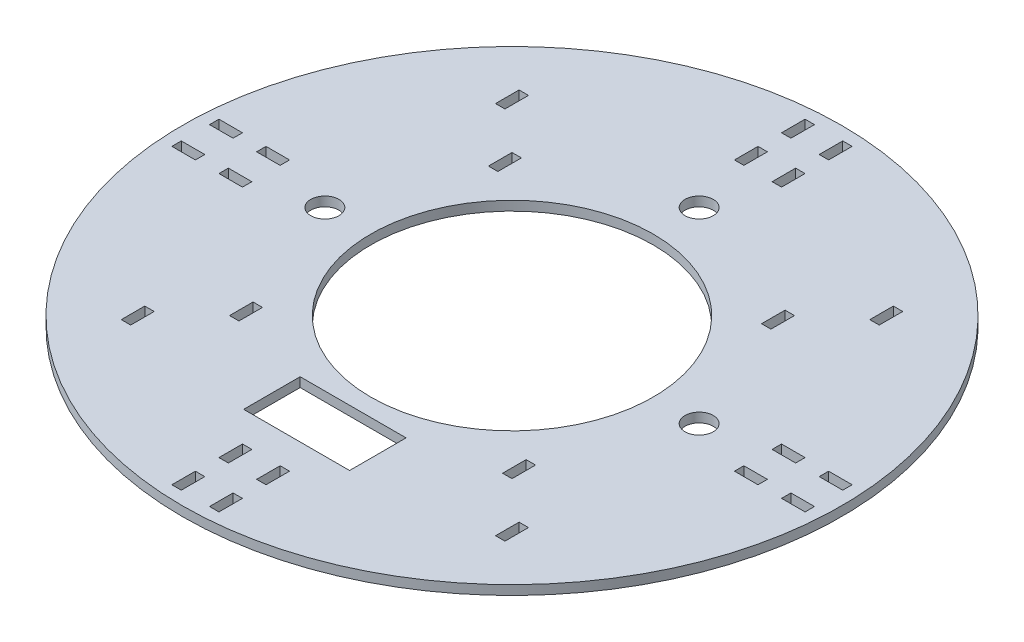
from build123d import *

# Parameters (mm, degrees)
SKETCH1_R                   = 70
SKETCH1_R_2                 = 30
SKETCH1_R_3                 = 3
SKETCH1_W                   = 2
SKETCH1_H                   = 5
SKETCH1_W_2                 = 22.5
SKETCH1_H_2                 = 12
SKETCH1_W_3                 = 5
SKETCH1_H_3                 = 2
Y_KSEKLIK_EKSTR_ZYON1_DEPTH = 2


with BuildPart() as part:
    # Sketch1 → Yükseklik-Ekstrüzyon1 (new body)
    with BuildSketch(Plane(origin=(0, 0, 0), x_dir=(1, 0, 0), z_dir=(0, 1, 0))):
        with Locations(Location((0, 0, 0), (0, 0, 270))):
            Circle(SKETCH1_R)
        with Locations(Location((0, 0, 0), (0, 0, 270))):
            Circle(SKETCH1_R_2, mode=Mode.SUBTRACT)
        with Locations(Location((39.748737342, 0, 0), (0, 0, 270))):
            Circle(SKETCH1_R_3, mode=Mode.SUBTRACT)
        with Locations(Location((-39.748737342, 0, 0), (0, 0, 270))):
            Circle(SKETCH1_R_3, mode=Mode.SUBTRACT)
        with Locations(Location((0, 39.748737342, 0), (0, 0, 270))):
            Circle(SKETCH1_R_3, mode=Mode.SUBTRACT)
        with Locations((-29, 27.5)):
            Rectangle(SKETCH1_W, SKETCH1_H, mode=Mode.SUBTRACT)
        with Locations((29, 27.5)):
            Rectangle(SKETCH1_W, SKETCH1_H, mode=Mode.SUBTRACT)
        with Locations((-29, -27.5)):
            Rectangle(SKETCH1_W, SKETCH1_H, mode=Mode.SUBTRACT)
        with Locations((29, -27.5)):
            Rectangle(SKETCH1_W, SKETCH1_H, mode=Mode.SUBTRACT)
        with Locations((-39.748737342, 39.748737342)):
            Rectangle(SKETCH1_W, SKETCH1_H, mode=Mode.SUBTRACT)
        with Locations((39.748737342, 39.748737342)):
            Rectangle(SKETCH1_W, SKETCH1_H, mode=Mode.SUBTRACT)
        with Locations((39.748737342, -39.748737342)):
            Rectangle(SKETCH1_W, SKETCH1_H, mode=Mode.SUBTRACT)
        with Locations((-39.748737342, -39.748737342)):
            Rectangle(SKETCH1_W, SKETCH1_H, mode=Mode.SUBTRACT)
        with Locations((0, -39.748737342)):
            Rectangle(SKETCH1_W_2, SKETCH1_H_2, mode=Mode.SUBTRACT)
        with Locations((-64.748737342, 4)):
            Rectangle(SKETCH1_W_3, SKETCH1_H_3, mode=Mode.SUBTRACT)
        with Locations((-64.748737342, -4)):
            Rectangle(SKETCH1_W_3, SKETCH1_H_3, mode=Mode.SUBTRACT)
        with Locations((-54.748737342, -4)):
            Rectangle(SKETCH1_W_3, SKETCH1_H_3, mode=Mode.SUBTRACT)
        with Locations((-54.748737342, 4)):
            Rectangle(SKETCH1_W_3, SKETCH1_H_3, mode=Mode.SUBTRACT)
        with Locations((-4, 64.748737342)):
            Rectangle(SKETCH1_W, SKETCH1_H, mode=Mode.SUBTRACT)
        with Locations((-4, 54.748737342)):
            Rectangle(SKETCH1_W, SKETCH1_H, mode=Mode.SUBTRACT)
        with Locations((4, 54.748737342)):
            Rectangle(SKETCH1_W, SKETCH1_H, mode=Mode.SUBTRACT)
        with Locations((4, 64.748737342)):
            Rectangle(SKETCH1_W, SKETCH1_H, mode=Mode.SUBTRACT)
        with Locations((54.748737342, 4)):
            Rectangle(SKETCH1_W_3, SKETCH1_H_3, mode=Mode.SUBTRACT)
        with Locations((54.748737342, -4)):
            Rectangle(SKETCH1_W_3, SKETCH1_H_3, mode=Mode.SUBTRACT)
        with Locations((64.748737342, 4)):
            Rectangle(SKETCH1_W_3, SKETCH1_H_3, mode=Mode.SUBTRACT)
        with Locations((64.748737342, -4)):
            Rectangle(SKETCH1_W_3, SKETCH1_H_3, mode=Mode.SUBTRACT)
        with Locations((-4, -54.748737342)):
            Rectangle(SKETCH1_W, SKETCH1_H, mode=Mode.SUBTRACT)
        with Locations((4, -54.748737342)):
            Rectangle(SKETCH1_W, SKETCH1_H, mode=Mode.SUBTRACT)
        with Locations((4, -64.748737342)):
            Rectangle(SKETCH1_W, SKETCH1_H, mode=Mode.SUBTRACT)
        with Locations((-4, -64.748737342)):
            Rectangle(SKETCH1_W, SKETCH1_H, mode=Mode.SUBTRACT)
    extrude(amount=Y_KSEKLIK_EKSTR_ZYON1_DEPTH)


solid = part.part
